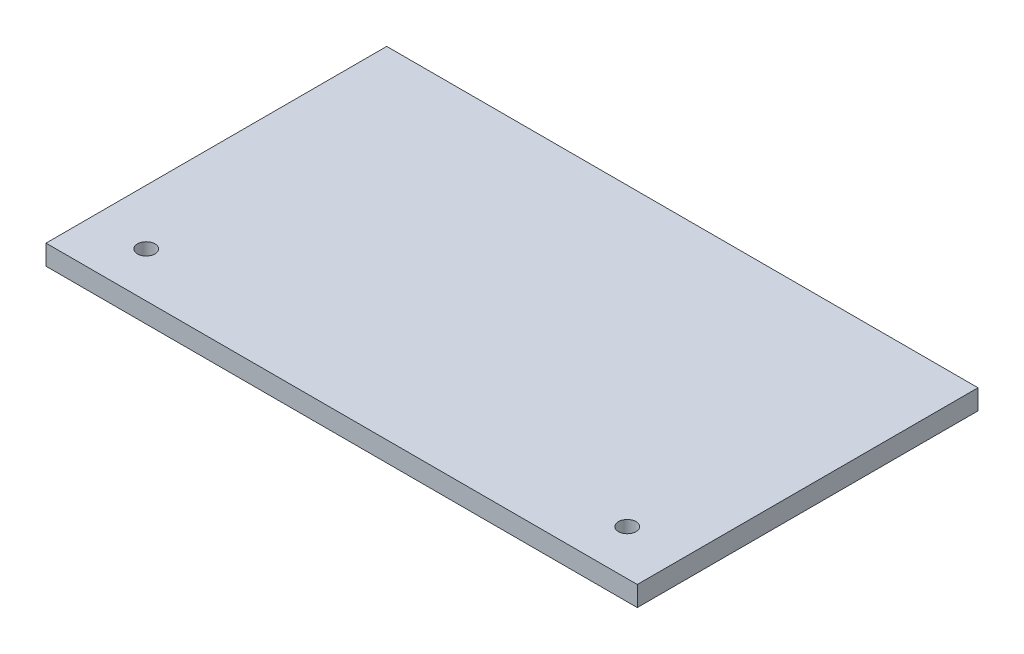
from build123d import *

# Parameters (mm, degrees)
SKETCH1_W               = 118
SKETCH1_H               = 68
SKETCH1_R               = 1.75
TRAY_BASE_EXTRUDE_DEPTH = 4


with BuildPart() as part:
    # Sketch1 → Tray_Base_Extrude (new body)
    with BuildSketch(Plane(origin=(0, 0, 0), x_dir=(1, 0, 0), z_dir=(0, 1, 0))):
        Rectangle(SKETCH1_W, SKETCH1_H)
        with Locations(Location((-48, -25, 0), (0, 0, 270))):
            Circle(SKETCH1_R, mode=Mode.SUBTRACT)
        with Locations(Location((48, -25, 0), (0, 0, 270))):
            Circle(SKETCH1_R, mode=Mode.SUBTRACT)
    extrude(amount=TRAY_BASE_EXTRUDE_DEPTH)


solid = part.part
